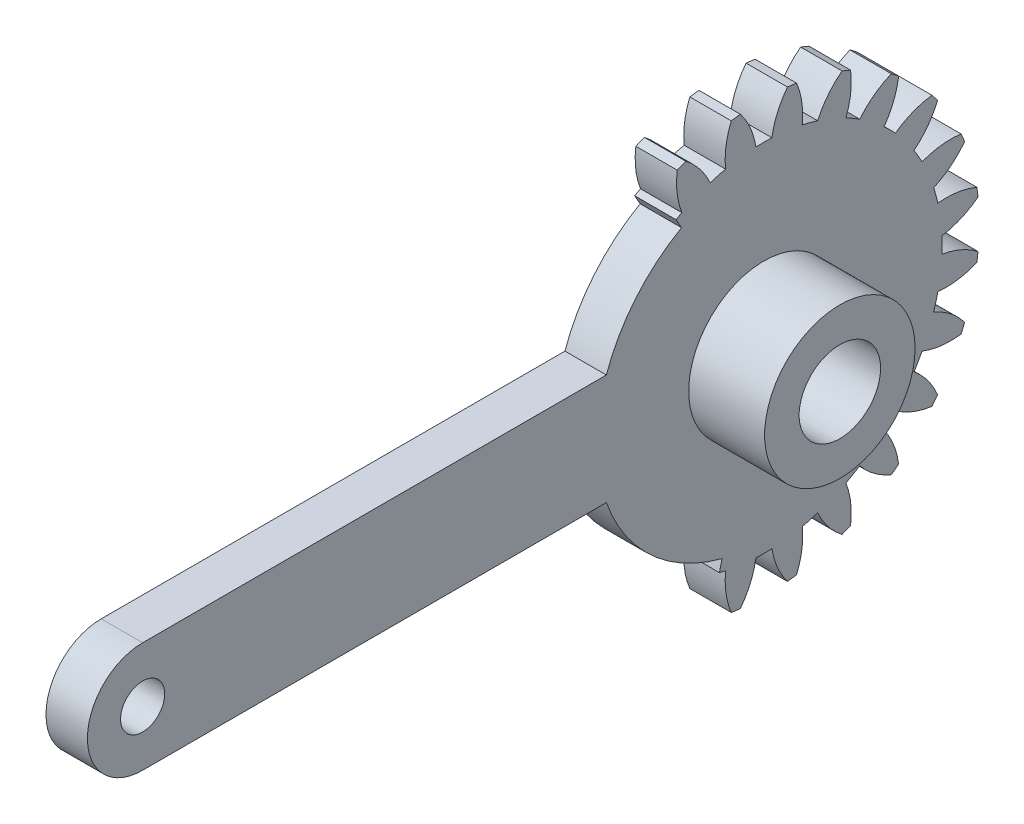
from build123d import *

# Parameters (mm, degrees)
SKETCH1_R           = 1.6
BOSS_EXTRUDE1_DEPTH = 3
SKETCH2_R           = 1.6
SKETCH2_R_2         = 1.75
BOSS_EXTRUDE2_DEPTH = 3
CUT_EXTRUDE1_DEPTH  = 10
SKETCH4_R           = 5.45
SKETCH4_R_2         = 2.95
BOSS_EXTRUDE3_DEPTH = 5.5


with BuildPart() as part:
    # Sketch1 → Boss-Extrude1 (new body)
    with BuildSketch(Plane(origin=(3, 0, 0), x_dir=(0, 0, -1), z_dir=(1, 0, 0))):
        with BuildLine():
            ThreePointArc((-15.506469218, 1.705699967), (-14.267058736, 0.977515599), (-12.885936189, 0.578903848))
            ThreePointArc((-12.885936189, 0.578903848), (-12.898933333, 0), (-12.885936189, -0.578903848))
            ThreePointArc((-12.885936189, -0.578903848), (-14.267058736, -0.977515599), (-15.506469218, -1.705699967))
            ThreePointArc((-15.506469218, -1.705699967), (-15.466539837, -2.036208599), (-15.419566729, -2.365789906))
            ThreePointArc((-15.419566729, -2.365789906), (-14.033920152, -2.748378956), (-12.596689902, -2.775947522))
            ThreePointArc((-12.596689902, -2.775947522), (-12.459412838, -3.338489608), (-12.29702722, -3.894303878))
            ThreePointArc((-12.29702722, -3.894303878), (-13.527920844, -4.636794081), (-14.536631456, -5.660949206))
            ThreePointArc((-14.536631456, -5.660949206), (-14.412520707, -5.969861545), (-14.281846249, -6.276055107))
            ThreePointArc((-14.281846249, -6.276055107), (-12.844393102, -6.286976026), (-11.449000016, -5.941622656))
            ThreePointArc((-11.449000016, -5.941622656), (-11.170803948, -6.449466667), (-10.870096167, -6.944313534))
            ThreePointArc((-10.870096167, -6.944313534), (-11.866877503, -7.98008271), (-12.576146283, -9.230414112))
            ThreePointArc((-12.576146283, -9.230414112), (-12.376312109, -9.496678293), (-12.17084155, -9.758617524))
            ThreePointArc((-12.17084155, -9.758617524), (-10.779541889, -9.397126071), (-9.521079698, -8.702386024))
            ThreePointArc((-9.521079698, -8.702386024), (-9.12092323, -9.12092323), (-8.702386024, -9.521079698))
            ThreePointArc((-8.702386024, -9.521079698), (-9.397126071, -10.779541889), (-9.758617524, -12.17084155))
            ThreePointArc((-9.758617524, -12.17084155), (-9.496678293, -12.376312109), (-9.230414112, -12.576146283))
            ThreePointArc((-9.230414112, -12.576146283), (-7.98008271, -11.866877503), (-6.944313534, -10.870096167))
            ThreePointArc((-6.944313534, -10.870096167), (-6.449466667, -11.170803948), (-5.941622656, -11.449000016))
            ThreePointArc((-5.941622656, -11.449000016), (-6.286976026, -12.844393102), (-6.276055107, -14.281846249))
            ThreePointArc((-6.276055107, -14.281846249), (-5.969861545, -14.412520707), (-5.660949206, -14.536631456))
            ThreePointArc((-5.660949206, -14.536631456), (-4.636794081, -13.527920844), (-3.894303878, -12.29702722))
            ThreePointArc((-3.894303878, -12.29702722), (-3.338489608, -12.459412838), (-2.775947522, -12.596689902))
            ThreePointArc((-2.775947522, -12.596689902), (-2.748378956, -14.033920152), (-2.365789906, -15.419566729))
            ThreePointArc((-2.365789906, -15.419566729), (-2.036208599, -15.466539837), (-1.705699967, -15.506469218))
            ThreePointArc((-1.705699967, -15.506469218), (-0.977515599, -14.267058736), (-0.578903848, -12.885936189))
            ThreePointArc((-0.578903848, -12.885936189), (0, -12.898933333), (0.578903848, -12.885936189))
            ThreePointArc((0.578903848, -12.885936189), (0.977515599, -14.267058736), (1.705699967, -15.506469218))
            ThreePointArc((1.705699967, -15.506469218), (2.036208599, -15.466539837), (2.365789906, -15.419566729))
            ThreePointArc((2.365789906, -15.419566729), (2.748378956, -14.033920152), (2.775947522, -12.596689902))
            ThreePointArc((2.775947522, -12.596689902), (3.338489608, -12.459412838), (3.894303878, -12.29702722))
            ThreePointArc((3.894303878, -12.29702722), (4.636794081, -13.527920844), (5.660949206, -14.536631456))
            ThreePointArc((5.660949206, -14.536631456), (5.969861545, -14.412520707), (6.276055107, -14.281846249))
            ThreePointArc((6.276055107, -14.281846249), (6.286976026, -12.844393102), (5.941622656, -11.449000016))
            ThreePointArc((5.941622656, -11.449000016), (6.449466667, -11.170803948), (6.944313534, -10.870096167))
            ThreePointArc((6.944313534, -10.870096167), (7.98008271, -11.866877503), (9.230414112, -12.576146283))
            ThreePointArc((9.230414112, -12.576146283), (9.496678293, -12.376312109), (9.758617524, -12.17084155))
            ThreePointArc((9.758617524, -12.17084155), (9.397126071, -10.779541889), (8.702386024, -9.521079698))
            ThreePointArc((8.702386024, -9.521079698), (9.12092323, -9.12092323), (9.521079698, -8.702386024))
            ThreePointArc((9.521079698, -8.702386024), (10.779541889, -9.397126071), (12.17084155, -9.758617524))
            ThreePointArc((12.17084155, -9.758617524), (12.376312109, -9.496678293), (12.576146283, -9.230414112))
            ThreePointArc((12.576146283, -9.230414112), (11.866877503, -7.98008271), (10.870096167, -6.944313534))
            ThreePointArc((10.870096167, -6.944313534), (11.170803948, -6.449466667), (11.449000016, -5.941622656))
            ThreePointArc((11.449000016, -5.941622656), (12.844393102, -6.286976026), (14.281846249, -6.276055107))
            ThreePointArc((14.281846249, -6.276055107), (14.412520707, -5.969861545), (14.536631456, -5.660949206))
            ThreePointArc((14.536631456, -5.660949206), (13.527920844, -4.636794081), (12.29702722, -3.894303878))
            ThreePointArc((12.29702722, -3.894303878), (12.459412838, -3.338489608), (12.596689902, -2.775947522))
            ThreePointArc((12.596689902, -2.775947522), (14.033920152, -2.748378956), (15.419566729, -2.365789906))
            ThreePointArc((15.419566729, -2.365789906), (15.466539837, -2.036208599), (15.506469218, -1.705699967))
            ThreePointArc((15.506469218, -1.705699967), (14.267058736, -0.977515599), (12.885936189, -0.578903848))
            ThreePointArc((12.885936189, -0.578903848), (12.898933333, 0), (12.885936189, 0.578903848))
            ThreePointArc((12.885936189, 0.578903848), (14.267058736, 0.977515599), (15.506469218, 1.705699967))
            ThreePointArc((15.506469218, 1.705699967), (15.466539837, 2.036208599), (15.419566729, 2.365789906))
            ThreePointArc((15.419566729, 2.365789906), (14.033920152, 2.748378956), (12.596689902, 2.775947522))
            ThreePointArc((12.596689902, 2.775947522), (12.459412838, 3.338489608), (12.29702722, 3.894303878))
            ThreePointArc((12.29702722, 3.894303878), (13.527920844, 4.636794081), (14.536631456, 5.660949206))
            ThreePointArc((14.536631456, 5.660949206), (14.412520707, 5.969861545), (14.281846249, 6.276055107))
            ThreePointArc((14.281846249, 6.276055107), (12.844393102, 6.286976026), (11.449000016, 5.941622656))
            ThreePointArc((11.449000016, 5.941622656), (11.170803948, 6.449466667), (10.870096167, 6.944313534))
            ThreePointArc((10.870096167, 6.944313534), (11.866877503, 7.98008271), (12.576146283, 9.230414112))
            ThreePointArc((12.576146283, 9.230414112), (12.376312109, 9.496678293), (12.17084155, 9.758617524))
            ThreePointArc((12.17084155, 9.758617524), (10.779541889, 9.397126071), (9.521079698, 8.702386024))
            ThreePointArc((9.521079698, 8.702386024), (9.12092323, 9.12092323), (8.702386024, 9.521079698))
            ThreePointArc((8.702386024, 9.521079698), (9.397126071, 10.779541889), (9.758617524, 12.17084155))
            ThreePointArc((9.758617524, 12.17084155), (9.496678293, 12.376312109), (9.230414112, 12.576146283))
            ThreePointArc((9.230414112, 12.576146283), (7.98008271, 11.866877503), (6.944313534, 10.870096167))
            ThreePointArc((6.944313534, 10.870096167), (6.449466667, 11.170803948), (5.941622656, 11.449000016))
            ThreePointArc((5.941622656, 11.449000016), (6.286976026, 12.844393102), (6.276055107, 14.281846249))
            ThreePointArc((6.276055107, 14.281846249), (5.969861545, 14.412520707), (5.660949206, 14.536631456))
            ThreePointArc((5.660949206, 14.536631456), (4.636794081, 13.527920844), (3.894303878, 12.29702722))
            ThreePointArc((3.894303878, 12.29702722), (3.338489608, 12.459412838), (2.775947522, 12.596689902))
            ThreePointArc((2.775947522, 12.596689902), (2.748378956, 14.033920152), (2.365789906, 15.419566729))
            ThreePointArc((2.365789906, 15.419566729), (2.036208599, 15.466539837), (1.705699967, 15.506469218))
            ThreePointArc((1.705699967, 15.506469218), (0.977515599, 14.267058736), (0.578903848, 12.885936189))
            ThreePointArc((0.578903848, 12.885936189), (0, 12.898933333), (-0.578903848, 12.885936189))
            ThreePointArc((-0.578903848, 12.885936189), (-0.977515599, 14.267058736), (-1.705699967, 15.506469218))
            ThreePointArc((-1.705699967, 15.506469218), (-2.036208599, 15.466539837), (-2.365789906, 15.419566729))
            ThreePointArc((-2.365789906, 15.419566729), (-2.748378956, 14.033920152), (-2.775947522, 12.596689902))
            ThreePointArc((-2.775947522, 12.596689902), (-3.338489608, 12.459412838), (-3.894303878, 12.29702722))
            ThreePointArc((-3.894303878, 12.29702722), (-4.636794081, 13.527920844), (-5.660949206, 14.536631456))
            ThreePointArc((-5.660949206, 14.536631456), (-5.969861545, 14.412520707), (-6.276055107, 14.281846249))
            ThreePointArc((-6.276055107, 14.281846249), (-6.286976026, 12.844393102), (-5.941622656, 11.449000016))
            ThreePointArc((-5.941622656, 11.449000016), (-6.449466667, 11.170803948), (-6.944313534, 10.870096167))
            ThreePointArc((-6.944313534, 10.870096167), (-7.98008271, 11.866877503), (-9.230414112, 12.576146283))
            ThreePointArc((-9.230414112, 12.576146283), (-9.496678293, 12.376312109), (-9.758617524, 12.17084155))
            ThreePointArc((-9.758617524, 12.17084155), (-9.397126071, 10.779541889), (-8.702386024, 9.521079698))
            ThreePointArc((-8.702386024, 9.521079698), (-9.12092323, 9.12092323), (-9.521079698, 8.702386024))
            ThreePointArc((-9.521079698, 8.702386024), (-10.779541889, 9.397126071), (-12.17084155, 9.758617524))
            ThreePointArc((-12.17084155, 9.758617524), (-12.376312109, 9.496678293), (-12.576146283, 9.230414112))
            ThreePointArc((-12.576146283, 9.230414112), (-11.866877503, 7.98008271), (-10.870096167, 6.944313534))
            ThreePointArc((-10.870096167, 6.944313534), (-11.170803948, 6.449466667), (-11.449000016, 5.941622656))
            ThreePointArc((-11.449000016, 5.941622656), (-12.844393102, 6.286976026), (-14.281846249, 6.276055107))
            ThreePointArc((-14.281846249, 6.276055107), (-14.412520707, 5.969861545), (-14.536631456, 5.660949206))
            ThreePointArc((-14.536631456, 5.660949206), (-13.527920844, 4.636794081), (-12.29702722, 3.894303878))
            ThreePointArc((-12.29702722, 3.894303878), (-12.459412838, 3.338489608), (-12.596689902, 2.775947522))
            ThreePointArc((-12.596689902, 2.775947522), (-14.033920152, 2.748378956), (-15.419566729, 2.365789906))
            ThreePointArc((-15.419566729, 2.365789906), (-15.466539837, 2.036208599), (-15.506469218, 1.705699967))
        make_face()
        with Locations(Location((0, 0, 0), (0, 0, 180))):
            Circle(SKETCH1_R, mode=Mode.SUBTRACT)
    extrude(amount=-BOSS_EXTRUDE1_DEPTH)

    # Sketch2 → Boss-Extrude2 (add)
    with BuildSketch(Plane(origin=(3, 0, 0), x_dir=(0, 0, -1), z_dir=(1, 0, 0))):
        with BuildLine():
            Line((0, -4), (-45, -4))
            ThreePointArc((-45, -4), (-49, 0), (-45, 4))
            Line((-45, 4), (0, 4))
            ThreePointArc((0, 4), (4, 0), (0, -4))
        make_face()
        with Locations((-45, 0)):
            Circle(SKETCH2_R, mode=Mode.SUBTRACT)
        Circle(SKETCH2_R_2, mode=Mode.SUBTRACT)
    extrude(amount=-BOSS_EXTRUDE2_DEPTH)

    # Sketch3 → Cut-Extrude1 (cut)
    with BuildSketch(Plane(origin=(3, 0, 0), x_dir=(0, 0, -1), z_dir=(1, 0, 0))):
        with BuildLine():
            Line((-12.521979493, 4), (-11.412037617, 4))
            ThreePointArc((-11.412037617, 4), (-9.280192177, 7.753233888), (-5.965971484, 10.51863997))
            Line((-5.965971484, 10.51863997), (-6.363702916, 11.219882635))
            ThreePointArc((-6.363702916, 11.219882635), (-6.656306265, 11.048803919), (-6.944313534, 10.870096167))
            ThreePointArc((-6.944313534, 10.870096167), (-7.98008271, 11.866877503), (-9.230414112, 12.576146283))
            ThreePointArc((-9.230414112, 12.576146283), (-9.496678293, 12.376312109), (-9.758617524, 12.17084155))
            ThreePointArc((-9.758617524, 12.17084155), (-9.397126071, 10.779541889), (-8.702386024, 9.521079698))
            ThreePointArc((-8.702386024, 9.521079698), (-9.12092323, 9.12092323), (-9.521079698, 8.702386024))
            ThreePointArc((-9.521079698, 8.702386024), (-10.779541889, 9.397126071), (-12.17084155, 9.758617524))
            ThreePointArc((-12.17084155, 9.758617524), (-12.376312109, 9.496678293), (-12.576146283, 9.230414112))
            ThreePointArc((-12.576146283, 9.230414112), (-11.866877503, 7.98008271), (-10.870096167, 6.944313534))
            ThreePointArc((-10.870096167, 6.944313534), (-11.170803948, 6.449466667), (-11.449000016, 5.941622656))
            ThreePointArc((-11.449000016, 5.941622656), (-12.844393102, 6.286976026), (-14.281846249, 6.276055107))
            ThreePointArc((-14.281846249, 6.276055107), (-14.412520707, 5.969861545), (-14.536631456, 5.660949206))
            ThreePointArc((-14.536631456, 5.660949206), (-13.624661268, 4.714812585), (-12.521979493, 4))
        make_face()
        with BuildLine():
            ThreePointArc((-3.024257119, -11.708478613), (-8.182714223, -8.903807641), (-11.412037617, -4))
            Line((-11.412037617, -4), (-12.521979493, -4))
            ThreePointArc((-12.521979493, -4), (-13.624661268, -4.714812585), (-14.536631456, -5.660949206))
            ThreePointArc((-14.536631456, -5.660949206), (-14.412520707, -5.969861545), (-14.281846249, -6.276055107))
            ThreePointArc((-14.281846249, -6.276055107), (-12.844393102, -6.286976026), (-11.449000016, -5.941622656))
            ThreePointArc((-11.449000016, -5.941622656), (-11.170803948, -6.449466667), (-10.870096167, -6.944313534))
            ThreePointArc((-10.870096167, -6.944313534), (-11.866877503, -7.98008271), (-12.576146283, -9.230414112))
            ThreePointArc((-12.576146283, -9.230414112), (-12.376312109, -9.496678293), (-12.17084155, -9.758617524))
            ThreePointArc((-12.17084155, -9.758617524), (-10.779541889, -9.397126071), (-9.521079698, -8.702386024))
            ThreePointArc((-9.521079698, -8.702386024), (-9.12092323, -9.12092323), (-8.702386024, -9.521079698))
            ThreePointArc((-8.702386024, -9.521079698), (-9.397126071, -10.779541889), (-9.758617524, -12.17084155))
            ThreePointArc((-9.758617524, -12.17084155), (-9.496678293, -12.376312109), (-9.230414112, -12.576146283))
            ThreePointArc((-9.230414112, -12.576146283), (-7.98008271, -11.866877503), (-6.944313534, -10.870096167))
            ThreePointArc((-6.944313534, -10.870096167), (-6.449466667, -11.170803948), (-5.941622656, -11.449000016))
            ThreePointArc((-5.941622656, -11.449000016), (-6.286976026, -12.844393102), (-6.276055107, -14.281846249))
            ThreePointArc((-6.276055107, -14.281846249), (-5.969861545, -14.412520707), (-5.660949206, -14.536631456))
            ThreePointArc((-5.660949206, -14.536631456), (-4.636794081, -13.527920844), (-3.894303878, -12.29702722))
            ThreePointArc((-3.894303878, -12.29702722), (-3.561383408, -12.397541263), (-3.22587426, -12.489043854))
            Line((-3.22587426, -12.489043854), (-3.024257119, -11.708478613))
        make_face()
    extrude(amount=-CUT_EXTRUDE1_DEPTH, mode=Mode.SUBTRACT)

    # Sketch4 → Boss-Extrude3 (add)
    with BuildSketch(Plane(origin=(3, 0, 0), x_dir=(0, 0, -1), z_dir=(1, 0, 0))):
        Circle(SKETCH4_R)
        Circle(SKETCH4_R_2, mode=Mode.SUBTRACT)
    extrude(amount=BOSS_EXTRUDE3_DEPTH)


solid = part.part
